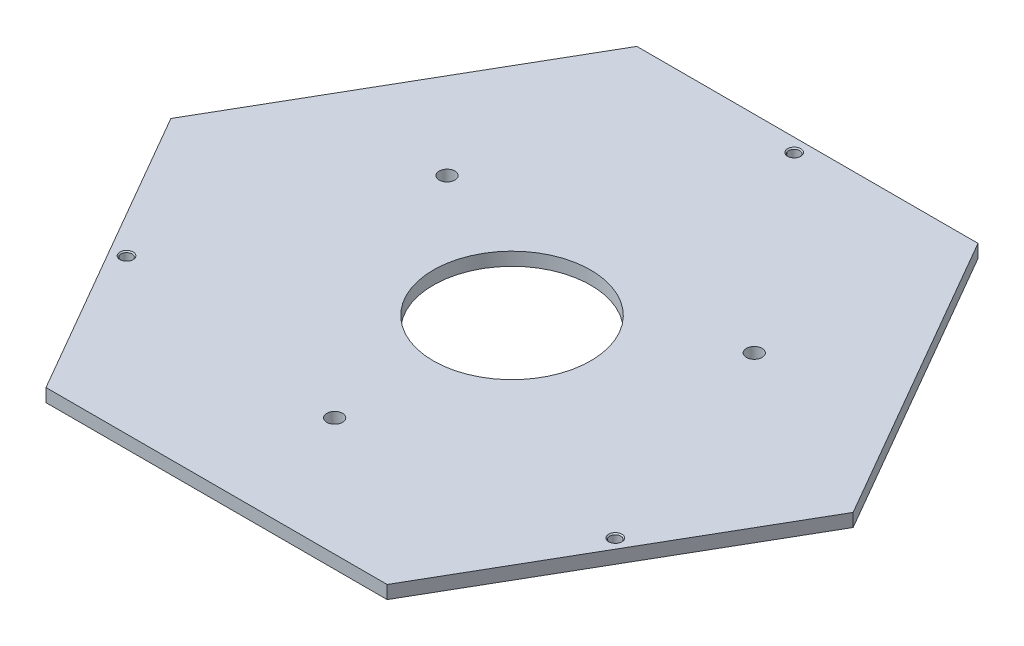
from build123d import *

# Parameters (mm, degrees)
EXTRUDE_1_DEPTH              = 5
SKETCH_2_R                   = 30
CUT_EXTRUDE_1_DEPTH          = 5
SKETCH_3_R                   = 3
CUT_EXTRUDE_2_DEPTH          = 5
HOLE_WIZARD_M5_3_D           = 4.2
HOLE_WIZARD_M5_3_CSINK_D     = 5.05
HOLE_WIZARD_M5_3_CSINK_ANGLE = 90


with BuildPart() as part:
    # 草图1 → 凸台-拉伸1 (new body)
    with BuildSketch(Plane(origin=(0, 0, 0), x_dir=(1, 0, 0), z_dir=(0, 1, 0))):
        Polygon((130, 0), (65, 112.583302492), (-65, 112.583302492), (-130, 0), (-65, -112.583302492), (65, -112.583302492), align=None)
    extrude(amount=EXTRUDE_1_DEPTH)

    # 草图2 → 切除-拉伸1 (cut)
    with BuildSketch(Plane(origin=(0, 5, 0), x_dir=(1, 0, 0), z_dir=(0, 1, 0))):
        with Locations(Location((0, 0, 0), (0, 0, 270))):
            Circle(SKETCH_2_R)
    extrude(amount=-CUT_EXTRUDE_1_DEPTH, mode=Mode.SUBTRACT)

    # 草图3 → 切除-拉伸2 (cut)
    with BuildSketch(Plane(origin=(0, 5, 0), x_dir=(1, 0, 0), z_dir=(0, 1, 0))):
        with Locations(Location((-58.52885683, 33.791651246, 0), (0, 0, 270))):
            Circle(SKETCH_3_R)
        with Locations(Location((58.52885683, 33.791651246, 0), (0, 0, 270))):
            Circle(SKETCH_3_R)
        with Locations(Location((0, -67.583302492, 0), (0, 0, 270))):
            Circle(SKETCH_3_R)
    extrude(amount=-CUT_EXTRUDE_2_DEPTH, mode=Mode.SUBTRACT)

    # M5 螺纹孔3 (through all)
    with Locations(Plane(origin=(0, 5, 0), x_dir=(1, 0, 0), z_dir=(0, 1, 0))):
        with Locations((0, 107.533302492), (-93.126571711, -53.766651246), (93.126571711, -53.766651246)):
            CounterSinkHole(HOLE_WIZARD_M5_3_D / 2, HOLE_WIZARD_M5_3_CSINK_D / 2, counter_sink_angle=HOLE_WIZARD_M5_3_CSINK_ANGLE)


solid = part.part
